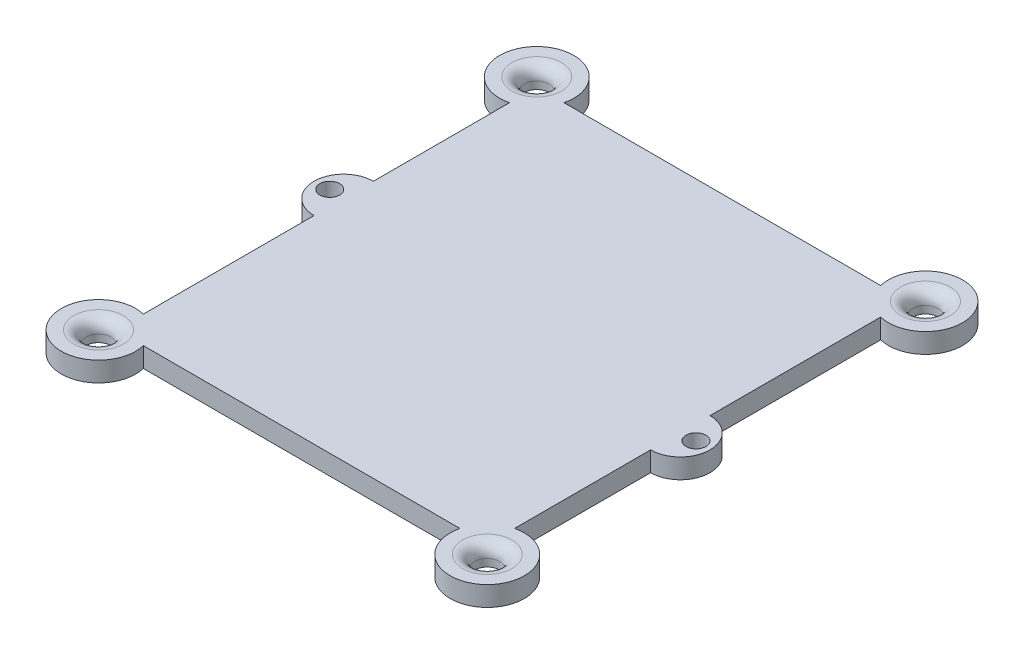
from build123d import *

# Parameters (mm, degrees)
SKETCH1_R           = 3.175
BOSS_EXTRUDE1_DEPTH = 5.08
SKETCH2_W           = 7.62
SKETCH2_H           = 5.08
REVOLVE1_ANGLE      = 180
SKETCH3_W           = 7.62
SKETCH3_H           = 5.08
REVOLVE2_ANGLE      = 180
SKETCH4_R           = 2.54
CUT_EXTRUDE1_DEPTH  = 161.661116131
SKETCH5_R           = 2.54
CUT_EXTRUDE2_DEPTH  = 161.661116131
FILLET1_R           = 3.175


with BuildPart() as part:
    # Sketch1 → Boss-Extrude1 (new body)
    with BuildSketch(Plane(origin=(0, 0, 0), x_dir=(1, 0, 0), z_dir=(0, 1, 0))):
        with BuildLine():
            Line((-7.011572103, 0), (-88.238427897, 0))
            ThreePointArc((-88.238427897, 0), (-104.230256121, 8.980256121), (-95.25, -7.011572103))
            Line((-95.25, -7.011572103), (-95.25, -100.938427897))
            ThreePointArc((-95.25, -100.938427897), (-104.230256121, -116.930256121), (-88.238427897, -107.95))
            Line((-88.238427897, -107.95), (-7.011572103, -107.95))
            ThreePointArc((-7.011572103, -107.95), (8.980256121, -116.930256121), (0, -100.938427897))
            Line((0, -100.938427897), (0, -7.011572103))
            ThreePointArc((0, -7.011572103), (8.980256121, 8.980256121), (-7.011572103, 0))
        make_face()
        with Locations(Location((-97.49506403, 2.24506403, 0), (0, 0, 270))):
            Circle(SKETCH1_R, mode=Mode.SUBTRACT)
        with Locations(Location((2.24506403, 2.24506403, 0), (0, 0, 270))):
            Circle(SKETCH1_R, mode=Mode.SUBTRACT)
        with Locations(Location((2.24506403, -110.19506403, 0), (0, 0, 270))):
            Circle(SKETCH1_R, mode=Mode.SUBTRACT)
        with Locations(Location((-97.49506403, -110.19506403, 0), (0, 0, 270))):
            Circle(SKETCH1_R, mode=Mode.SUBTRACT)
    extrude(amount=BOSS_EXTRUDE1_DEPTH)

    # Sketch2 → Revolve1 (revolve)
    with BuildSketch(Plane.ZY.offset(95.25)):
        with Locations((53.34, 2.54)):
            Rectangle(SKETCH2_W, SKETCH2_H)
    revolve(axis=Axis((-95.25, 5.08, 49.53), (0, -1, 0)), revolution_arc=REVOLVE1_ANGLE)

    # Sketch3 → Revolve2 (revolve)
    with BuildSketch(Plane(origin=(0, 0, 0), x_dir=(0, 0, -1), z_dir=(1, 0, 0))):
        with Locations((-62.23, 2.54)):
            Rectangle(SKETCH3_W, SKETCH3_H)
    revolve(axis=Axis((0, 5.08, 58.42), (0, 1, 0)), revolution_arc=REVOLVE2_ANGLE)

    # Sketch4 → Cut-Extrude1 (cut, through all)
    with BuildSketch(Plane(origin=(0, 5.08, 0), x_dir=(1, 0, 0), z_dir=(0, 1, 0))):
        with Locations(Location((-99.053632383, -49.309816677, 0), (0, 0, 270))):
            Circle(SKETCH4_R)
    extrude(amount=-CUT_EXTRUDE1_DEPTH, mode=Mode.SUBTRACT)

    # Sketch5 → Cut-Extrude2 (cut, through all)
    with BuildSketch(Plane(origin=(0, 5.08, 0), x_dir=(1, 0, 0), z_dir=(0, 1, 0))):
        with Locations(Location((3.804450658, -58.214439329, 0), (0, 0, 270))):
            Circle(SKETCH5_R)
    extrude(amount=-CUT_EXTRUDE2_DEPTH, mode=Mode.SUBTRACT)

    # Fillet1
    fillet1_edges = [part.edges().sort_by_distance(p)[0] for p in [
        (-97.49506403, 5.08, -5.42006403),
        (2.24506403, 5.08, -5.42006403),
        (2.24506403, 5.08, 107.02006403),
        (-97.49506403, 5.08, 107.02006403),
    ]]
    fillet(fillet1_edges, radius=FILLET1_R)


solid = part.part
